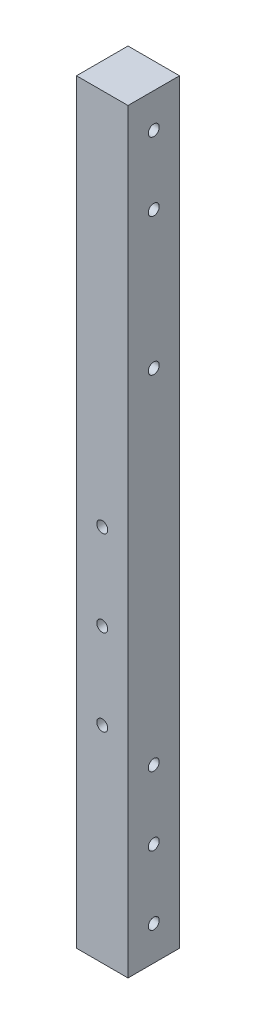
from build123d import *

# Parameters (mm, degrees)
SKETCH_1_W               = 15
SKETCH_1_H               = 15
EXTRUDE_1_DEPTH          = 220
SKETCH_2_R               = 1.6
CUT_EXTRUDE_1_DEPTH      = 222.020361053
CUT_EXTRUDE_2_DEPTH      = 222.020361053
CUT_EXTRUDE_2_DEPTH_BACK = 222.020361053
SKETCH_3_R               = 1.6


with BuildPart() as part:
    # 草图1 → 凸台-拉伸1 (new body)
    with BuildSketch(Plane(origin=(0, 0, 0), x_dir=(1, 0, 0), z_dir=(0, 1, 0))):
        with Locations((7.5, 7.5)):
            Rectangle(SKETCH_1_W, SKETCH_1_H)
    extrude(amount=EXTRUDE_1_DEPTH)

    # 草图2 → 切除-拉伸1 (cut, through all)
    with BuildSketch(Plane.XY):
        with Locations((7.5, 60)):
            Circle(SKETCH_2_R)
        with Locations((7.5, 85)):
            Circle(SKETCH_2_R)
        with Locations((7.5, 110)):
            Circle(SKETCH_2_R)
    extrude(amount=-CUT_EXTRUDE_1_DEPTH, mode=Mode.SUBTRACT)

    # 草图3 → 切除-拉伸2 (cut, two sides: drawn at the far end of the back side and taken through both)
    with BuildSketch(Plane.ZY.offset(-CUT_EXTRUDE_2_DEPTH_BACK)):
        with Locations((-7.5, 50)):
            Circle(SKETCH_3_R)
        with Locations((-7.5, 10)):
            Circle(SKETCH_3_R)
        with Locations((-7.5, 30)):
            Circle(SKETCH_3_R)
        with Locations((-7.5, 210)):
            Circle(SKETCH_3_R)
        with Locations((-7.5, 190)):
            Circle(SKETCH_3_R)
        with Locations((-7.5, 150)):
            Circle(SKETCH_3_R)
    extrude(amount=CUT_EXTRUDE_2_DEPTH + CUT_EXTRUDE_2_DEPTH_BACK, mode=Mode.SUBTRACT)


solid = part.part
